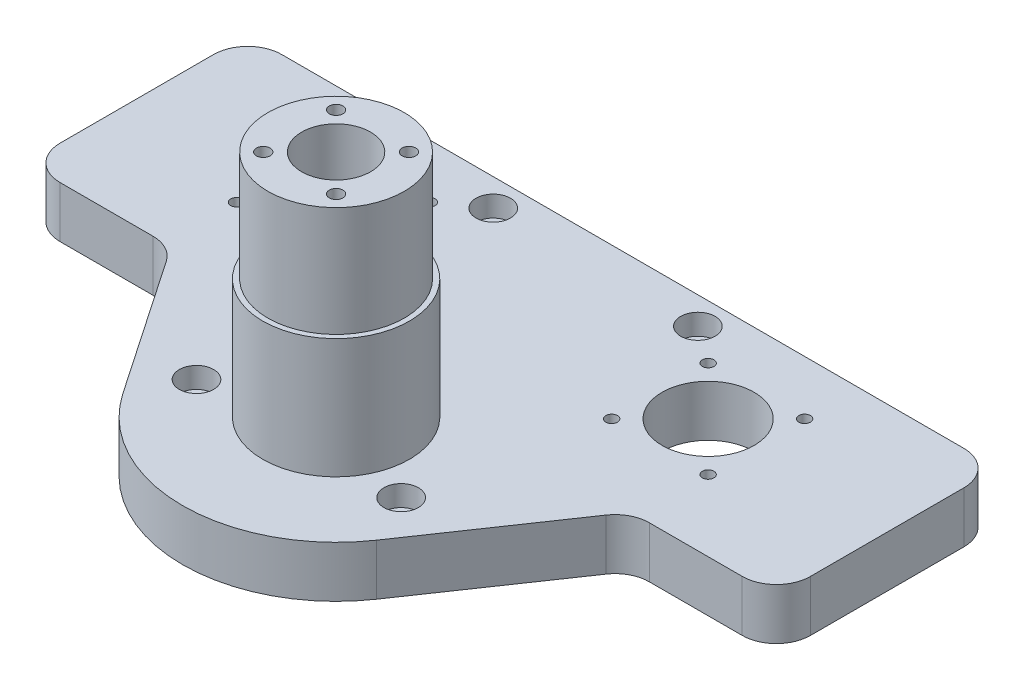
from build123d import *

# Parameters (mm, degrees)
MAIN_BODY_DEPTH                 = 15
SKETCH3_R                       = 21.5
FRONT_EXTRUSION_DEPTH           = 67.3
SKETCH4_R                       = 10.1
SKETCH4_R_2                     = 13.5
SKETCH4_R_3                     = 2
SKETCH4_R_4                     = 1.7
SKETCH4_R_5                     = 3
BOLT_HOLES_DEPTH                = 162.060825691
BOLT_RECESSES_REAR_DEPTH        = 10
SKETCH6_R                       = 5.05
BOLT_RECESSES_FRONT_DEPTH       = 6.1
CUT_EXTRUDE1_START              = -32.2
SKETCH7_R                       = 21.5
SKETCH7_R_2                     = 20
CUT_EXTRUDE1_DEPTH              = 32.2
SKETCH8_R                       = 2.85
MOTOR_BOLT_HEAD_RECESSES_DEPTH  = 6
SKETCH9_R                       = 2
HEAT_SET_INSERT_HOLES_DEPTH     = 6
SKETCH10_R                      = 1.6
PCB_HEAT_SET_INSERT_HOLES_DEPTH = 4


with BuildPart() as part:
    # Sketch1 → Main Body (new body)
    with BuildSketch(Plane(origin=(0, 0, 0), x_dir=(1, 0, 0), z_dir=(0, 1, 0))):
        with BuildLine():
            Line((55, 84.067232452), (-55, 84.067232452))
            Line((-55, 84.067232452), (-100, 84.067232452))
            ThreePointArc((-100, 84.067232452), (-107.071067812, 81.138300264), (-110, 74.067232452))
            Line((-110, 74.067232452), (-110, 29.067232452))
            ThreePointArc((-110, 29.067232452), (-107.071067812, 21.99616464), (-100, 19.067232452))
            Line((-100, 19.067232452), (-72.737775696, 19.067232452))
            ThreePointArc((-72.737775696, 19.067232452), (-68.06426999, 17.90795326), (-64.474343867, 14.698901335))
            Line((-64.474343867, 14.698901335), (-37.18544323, -25.342509974))
            ThreePointArc((-37.18544323, -25.342509974), (0, -45), (37.18544323, -25.342509974))
            Line((37.18544323, -25.342509974), (64.474343867, 14.698901335))
            ThreePointArc((64.474343867, 14.698901335), (68.06426999, 17.90795326), (72.737775696, 19.067232452))
            Line((72.737775696, 19.067232452), (100, 19.067232452))
            ThreePointArc((100, 19.067232452), (107.071067812, 21.99616464), (110, 29.067232452))
            Line((110, 29.067232452), (110, 74.067232452))
            ThreePointArc((110, 74.067232452), (107.071067812, 81.138300264), (100, 84.067232452))
            Line((100, 84.067232452), (55, 84.067232452))
        make_face()
    extrude(amount=MAIN_BODY_DEPTH)

    # Sketch3 → Front Extrusion (add)
    with BuildSketch(Plane(origin=(0, 15, 0), x_dir=(1, 0, 0), z_dir=(0, 1, 0))):
        with Locations(Location((0, 0, 0), (0, 0, 270))):
            Circle(SKETCH3_R)
    extrude(amount=FRONT_EXTRUSION_DEPTH)

    # Sketch4 → Bolt Holes (cut, through all)
    with BuildSketch(Plane.XZ):
        with Locations(Location((0, 0, 0), (0, 0, 270))):
            Circle(SKETCH4_R)
        with Locations(Location((-55, -54.067232452, 0), (0, 0, 270))):
            Circle(SKETCH4_R_2)
        with Locations(Location((-10.677312396, 10.677312396, 0), (0, 0, 270))):
            Circle(SKETCH4_R_3)
        with Locations(Location((-10.677312396, -10.677312396, 0), (0, 0, 90))):
            Circle(SKETCH4_R_3)
        with Locations(Location((-69.142135624, -39.925096828, 0), (0, 0, 270))):
            Circle(SKETCH4_R_4)
        with Locations(Location((-69.142135624, -68.209368076, 0), (0, 0, 90))):
            Circle(SKETCH4_R_4)
        with Locations(Location((-40.857864376, -68.209368076, 0), (0, 0, 270))):
            Circle(SKETCH4_R_4)
        with Locations(Location((-40.857864376, -39.925096828, 0), (0, 0, 90))):
            Circle(SKETCH4_R_4)
        with Locations(Location((55, -54.067232452, 0), (0, 0, 90))):
            Circle(SKETCH4_R_2)
        with Locations(Location((69.142135624, -68.209368076, 0), (0, 0, 270))):
            Circle(SKETCH4_R_4)
        with Locations(Location((40.857864376, -68.209368076, 0), (0, 0, 90))):
            Circle(SKETCH4_R_4)
        with Locations(Location((40.857864376, -39.925096828, 0), (0, 0, 270))):
            Circle(SKETCH4_R_4)
        with Locations(Location((69.142135624, -39.925096828, 0), (0, 0, 90))):
            Circle(SKETCH4_R_4)
        with Locations(Location((10.677312396, -10.677312396, 0), (0, 0, 270))):
            Circle(SKETCH4_R_3)
        with Locations(Location((10.677312396, 10.677312396, 0), (0, 0, 90))):
            Circle(SKETCH4_R_3)
        with Locations(Location((-30, -76.067232452, 0), (0, 0, 270))):
            Circle(SKETCH4_R_5)
        with Locations(Location((-30, 10.932767548, 0), (0, 0, 270))):
            Circle(SKETCH4_R_5)
        with Locations(Location((30, -76.067232452, 0), (0, 0, 90))):
            Circle(SKETCH4_R_5)
        with Locations(Location((30, 10.932767548, 0), (0, 0, 90))):
            Circle(SKETCH4_R_5)
    extrude(amount=-BOLT_HOLES_DEPTH, mode=Mode.SUBTRACT)

    # Sketch5 → Bolt Recesses Rear (cut)
    with BuildSketch(Plane.XZ):
        with BuildLine():
            Line((-14.919953083, 6.434671709), (-9.987638511, 1.502357137))
            ThreePointArc((-9.987638511, 1.502357137), (-7.14177849, 7.14177849), (-1.502357137, 9.987638511))
            Line((-1.502357137, 9.987638511), (-6.434671709, 14.919953083))
            ThreePointArc((-6.434671709, 14.919953083), (-14.919953083, 14.919953083), (-14.919953083, 6.434671709))
        make_face()
        with BuildLine():
            Line((-14.919953083, -6.434671709), (-9.987638511, -1.502357137))
            ThreePointArc((-9.987638511, -1.502357137), (-7.14177849, -7.14177849), (-1.502357137, -9.987638511))
            Line((-1.502357137, -9.987638511), (-6.434671709, -14.919953083))
            ThreePointArc((-6.434671709, -14.919953083), (-14.919953083, -14.919953083), (-14.919953083, -6.434671709))
        make_face()
        with BuildLine():
            Line((6.434671709, -14.919953083), (1.502357137, -9.987638511))
            ThreePointArc((1.502357137, -9.987638511), (7.14177849, -7.14177849), (9.987638511, -1.502357137))
            Line((9.987638511, -1.502357137), (14.919953083, -6.434671709))
            ThreePointArc((14.919953083, -6.434671709), (14.919953083, -14.919953083), (6.434671709, -14.919953083))
        make_face()
        with BuildLine():
            Line((14.919953083, 6.434671709), (9.987638511, 1.502357137))
            ThreePointArc((9.987638511, 1.502357137), (7.14177849, 7.14177849), (1.502357137, 9.987638511))
            Line((1.502357137, 9.987638511), (6.434671709, 14.919953083))
            ThreePointArc((6.434671709, 14.919953083), (14.919953083, 14.919953083), (14.919953083, 6.434671709))
        make_face()
    extrude(amount=-BOLT_RECESSES_REAR_DEPTH, mode=Mode.SUBTRACT)

    # Sketch6 → Bolt Recesses Front (cut)
    with BuildSketch(Plane(origin=(0, 15, 0), x_dir=(1, 0, 0), z_dir=(0, 1, 0))):
        with Locations(Location((30, 76.067232452, 0), (0, 0, 270))):
            Circle(SKETCH6_R)
        with Locations(Location((-30, 76.067232452, 0), (0, 0, 270))):
            Circle(SKETCH6_R)
        with Locations(Location((-30, -10.932767548, 0), (0, 0, 270))):
            Circle(SKETCH6_R)
        with Locations(Location((30, -10.932767548, 0), (0, 0, 270))):
            Circle(SKETCH6_R)
    extrude(amount=-BOLT_RECESSES_FRONT_DEPTH, mode=Mode.SUBTRACT)

    # Sketch7 → Cut-Extrude1 (cut)
    with BuildSketch(Plane(origin=(0, 82.3, 0), x_dir=(1, 0, 0), z_dir=(0, 1, 0)).offset(CUT_EXTRUDE1_START)):
        with Locations(Location((0, 0, 0), (0, 0, 270))):
            Circle(SKETCH7_R)
        with Locations(Location((0, 0, 0), (0, 0, 270))):
            Circle(SKETCH7_R_2, mode=Mode.SUBTRACT)
    extrude(amount=CUT_EXTRUDE1_DEPTH, mode=Mode.SUBTRACT)

    # Sketch8 → Motor bolt head recesses (cut)
    with BuildSketch(Plane.XZ):
        with Locations(Location((-69.142135624, -39.925096828, 0), (0, 0, 270))):
            Circle(SKETCH8_R)
        with Locations(Location((-40.857864376, -39.925096828, 0), (0, 0, 270))):
            Circle(SKETCH8_R)
        with Locations(Location((-40.857864376, -68.209368076, 0), (0, 0, 270))):
            Circle(SKETCH8_R)
        with Locations(Location((-69.142135624, -68.209368076, 0), (0, 0, 270))):
            Circle(SKETCH8_R)
        with Locations(Location((40.857864376, -68.209368076, 0), (0, 0, 90))):
            Circle(SKETCH8_R)
        with Locations(Location((40.857864376, -39.925096828, 0), (0, 0, 90))):
            Circle(SKETCH8_R)
        with Locations(Location((69.142135624, -68.209368076, 0), (0, 0, 90))):
            Circle(SKETCH8_R)
        with Locations(Location((69.142135624, -39.925096828, 0), (0, 0, 90))):
            Circle(SKETCH8_R)
    extrude(amount=-MOTOR_BOLT_HEAD_RECESSES_DEPTH, mode=Mode.SUBTRACT)

    # Sketch9 → Heat-set insert holes (cut)
    with BuildSketch(Plane.XZ):
        with Locations(Location((-106, -74.067232452, 0), (0, 0, 270))):
            Circle(SKETCH9_R)
        with Locations(Location((-106, -32.067232452, 0), (0, 0, 270))):
            Circle(SKETCH9_R)
        with Locations(Location((-44, -32.067232452, 0), (0, 0, 270))):
            Circle(SKETCH9_R)
        with Locations(Location((-44, -74.067232452, 0), (0, 0, 270))):
            Circle(SKETCH9_R)
        with Locations(Location((44, -74.067232452, 0), (0, 0, 90))):
            Circle(SKETCH9_R)
        with Locations(Location((106, -74.067232452, 0), (0, 0, 90))):
            Circle(SKETCH9_R)
        with Locations(Location((44, -32.067232452, 0), (0, 0, 90))):
            Circle(SKETCH9_R)
        with Locations(Location((106, -32.067232452, 0), (0, 0, 90))):
            Circle(SKETCH9_R)
    extrude(amount=-HEAT_SET_INSERT_HOLES_DEPTH, mode=Mode.SUBTRACT)

    # Sketch10 → PCB Heat-set insert holes (cut)
    with BuildSketch(Plane.XZ):
        with Locations(Location((-95, -72.067232452, 0), (0, 0, 270))):
            Circle(SKETCH10_R)
        with Locations(Location((-95, -34.067232452, 0), (0, 0, 270))):
            Circle(SKETCH10_R)
        with Locations(Location((-55, -34.067232452, 0), (0, 0, 270))):
            Circle(SKETCH10_R)
        with Locations(Location((-55, -72.067232452, 0), (0, 0, 270))):
            Circle(SKETCH10_R)
        with Locations(Location((95, -72.067232452, 0), (0, 0, 90))):
            Circle(SKETCH10_R)
        with Locations(Location((55, -72.067232452, 0), (0, 0, 90))):
            Circle(SKETCH10_R)
        with Locations(Location((55, -34.067232452, 0), (0, 0, 90))):
            Circle(SKETCH10_R)
        with Locations(Location((95, -34.067232452, 0), (0, 0, 90))):
            Circle(SKETCH10_R)
    extrude(amount=-PCB_HEAT_SET_INSERT_HOLES_DEPTH, mode=Mode.SUBTRACT)


solid = part.part
